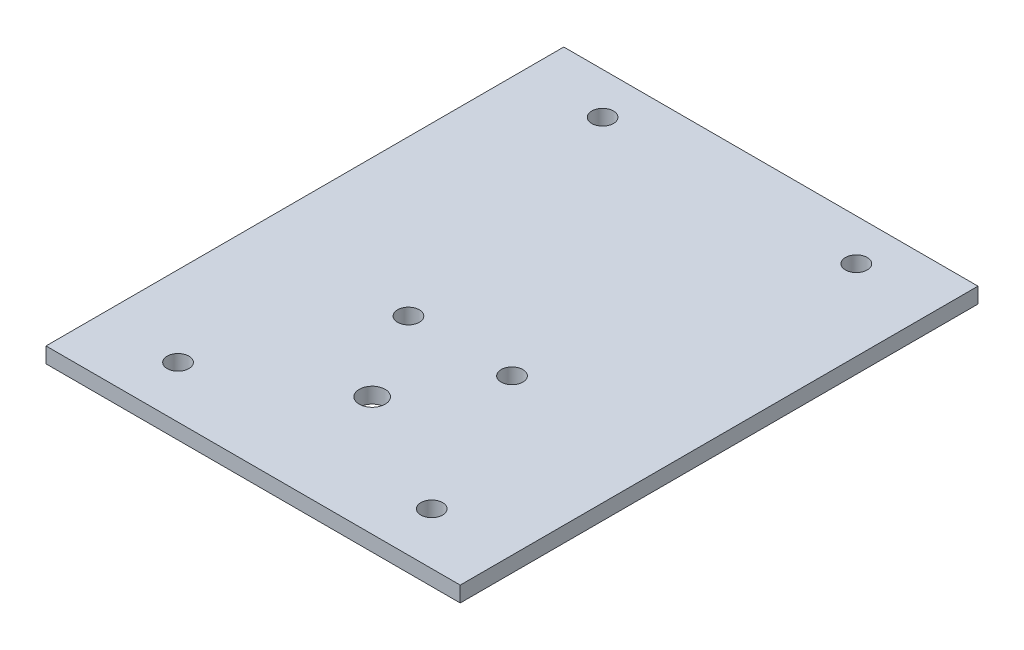
from build123d import *

# Parameters (mm, degrees)
SKETCH1_W           = 80
SKETCH1_H           = 100
SKETCH1_R           = 2.1
SKETCH1_R_2         = 2.5
BOSS_EXTRUDE1_DEPTH = 3


with BuildPart() as part:
    # Sketch1 → Boss-Extrude1 (new body)
    with BuildSketch(Plane(origin=(0, 0, 0), x_dir=(1, 0, 0), z_dir=(0, 1, 0))):
        Rectangle(SKETCH1_W, SKETCH1_H)
        with Locations(Location((24.5, 42, 0), (0, 0, 90))):
            Circle(SKETCH1_R, mode=Mode.SUBTRACT)
        with Locations(Location((-24.5, 42, 0), (0, 0, 270))):
            Circle(SKETCH1_R, mode=Mode.SUBTRACT)
        with Locations(Location((24.5, -40, 0), (0, 0, 270))):
            Circle(SKETCH1_R, mode=Mode.SUBTRACT)
        with Locations(Location((-24.5, -40, 0), (0, 0, 270))):
            Circle(SKETCH1_R, mode=Mode.SUBTRACT)
        with Locations(Location((10, -10, 0), (0, 0, 270))):
            Circle(SKETCH1_R, mode=Mode.SUBTRACT)
        with Locations(Location((-10, -10, 0), (0, 0, 270))):
            Circle(SKETCH1_R, mode=Mode.SUBTRACT)
        with Locations(Location((0, -27, 0), (0, 0, 270))):
            Circle(SKETCH1_R_2, mode=Mode.SUBTRACT)
    extrude(amount=BOSS_EXTRUDE1_DEPTH)


solid = part.part
